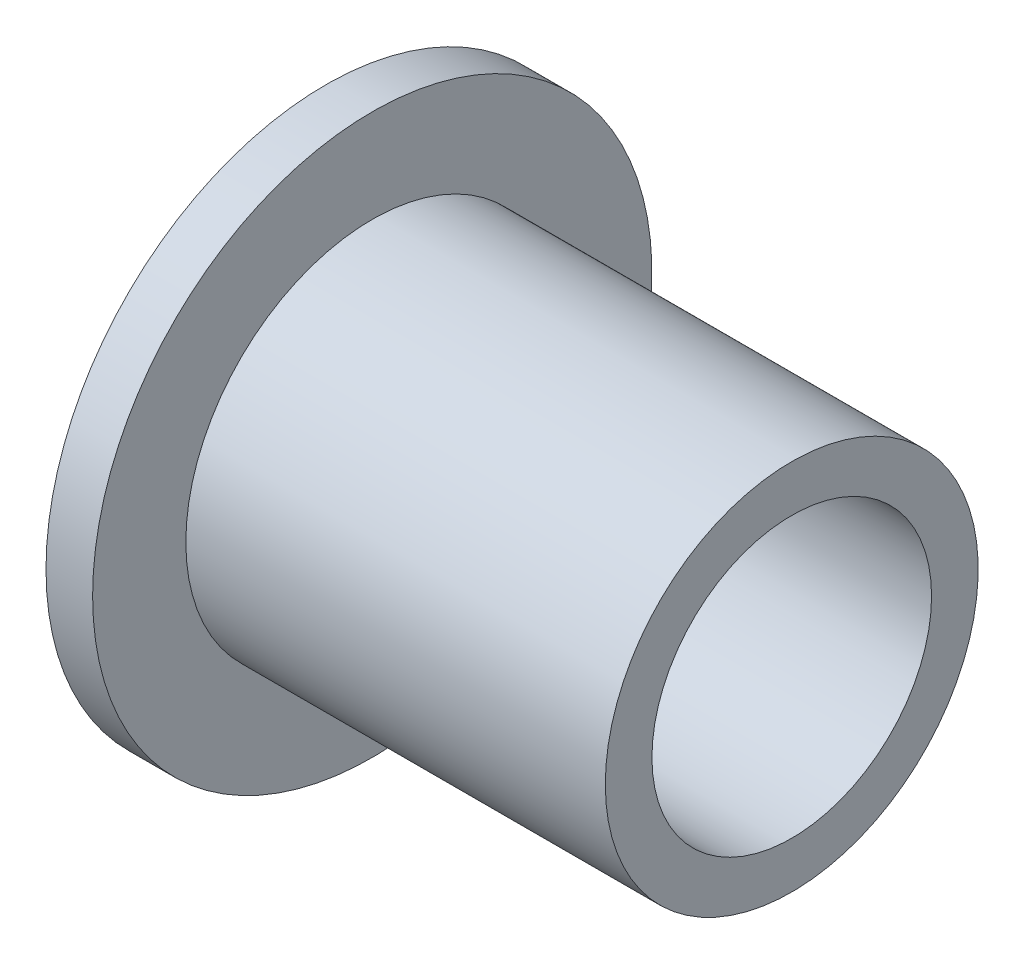
from build123d import *


with BuildPart() as part:
    # Esquisse1 → Révolution1 (revolve)
    with BuildSketch(Plane.XY, mode=Mode.PRIVATE) as r_volution1_sk:
        Polygon((10, 3), (10, 4), (1, 4), (1, 6), (0, 6), (0, 3), align=None)
    revolve(r_volution1_sk.sketch.rotate(Axis((0, 0, 0), (1, 0, 0)), 90), axis=Axis((0, 0, 0), (1, 0, 0)))


solid = part.part
